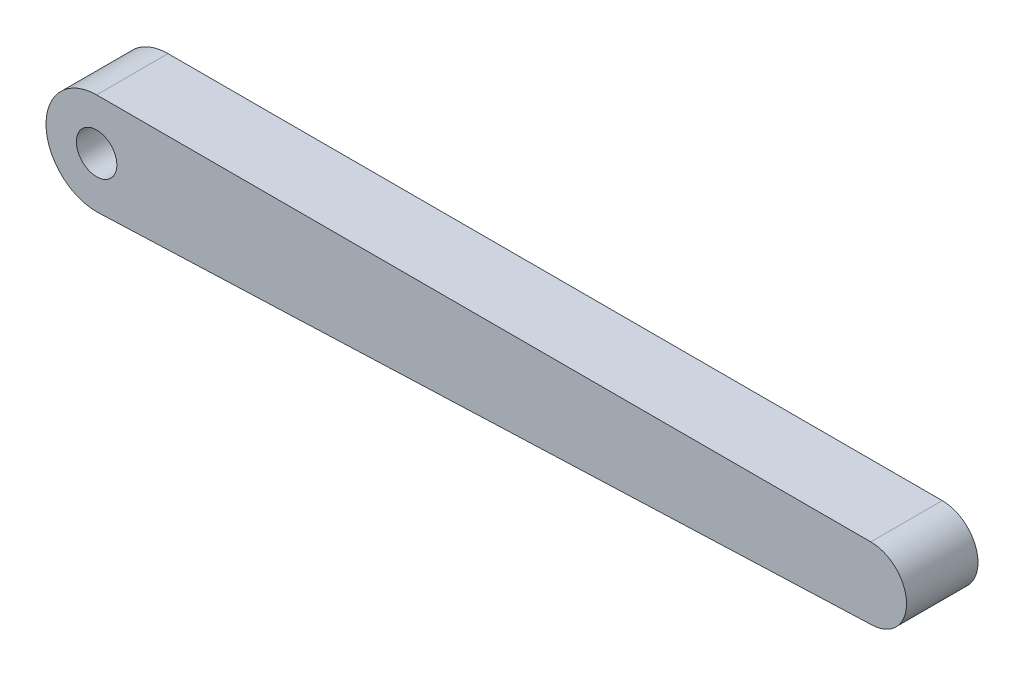
from build123d import *

# Parameters (mm, degrees)
EXTRUDE_1_DEPTH     = 6
SKETCH_3_R          = 1.7
CUT_EXTRUDE_1_DEPTH = 3.5


with BuildPart() as part:
    # 草图2 → 凸台-拉伸1 (new body)
    with BuildSketch(Plane.XY):
        with BuildLine():
            Line((0, 0), (65, 0))
            ThreePointArc((65, 0), (68, -3), (65, -6))
            Line((65, -6), (0, -8.5))
            ThreePointArc((0, -8.5), (-4.25, -4.25), (0, 0))
        make_face()
    extrude(amount=EXTRUDE_1_DEPTH)

    # 草图3 → 切除-拉伸1 (cut)
    with BuildSketch(Plane.XY.offset(6)):
        with Locations((0, -4.25)):
            Circle(SKETCH_3_R)
    extrude(amount=-CUT_EXTRUDE_1_DEPTH, mode=Mode.SUBTRACT)


solid = part.part
